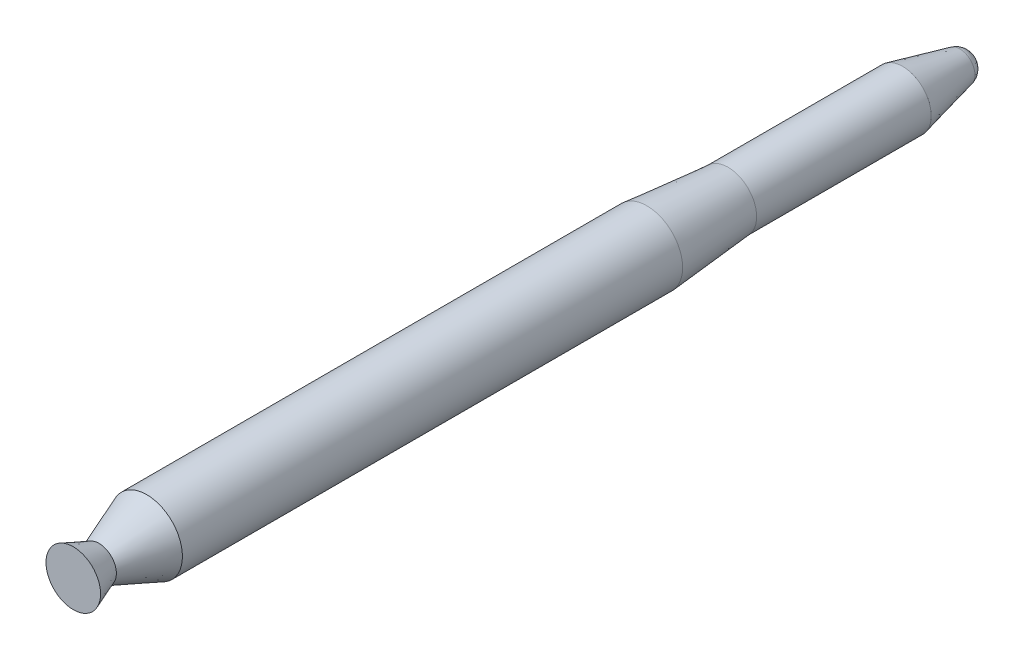
from build123d import *


with BuildPart() as part:
    # Sketch1 → Revolve1 (revolve)
    with BuildSketch(Plane(origin=(0, 0, 0), x_dir=(1, 0, 0), z_dir=(0, 1, 0))):
        with BuildLine():
            Line((2500, 0), (2500, 35000))
            Line((2500, 35000), (2000, 40678.027826631))
            Line((2000, 40678.027826631), (2000, 45962.41287874))
            Line((2000, 45962.41287874), (2000, 52893.41287874))
            Line((2000, 52893.41287874), (1060.397399135, 56895.743003017))
            ThreePointArc((1060.397399135, 56895.743003017), (673.272797982, 57477.208988598), (0, 57663.41287874))
            Line((0, 57663.41287874), (0, 49300))
            Line((0, 49300), (0, 40678.027826631))
            Line((0, 40678.027826631), (0, 35000))
            Line((0, 35000), (0, 0))
            Line((0, 0), (0, -3336.58712126))
            Line((0, -3336.58712126), (1215, -3336.58712126))
            Line((1215, -3336.58712126), (2500, 0))
        make_face()
    revolve(axis=Axis((0, 0, 0), (0, 0, -1)))

    # Sketch2 → Revolve2 (revolve)
    with BuildSketch(Plane(origin=(0, 0, 0), x_dir=(1, 0, 0), z_dir=(0, 1, 0))):
        Polygon((1215, -3336.58712126), (1909.097144705, -5136.58712126), (0, -5136.58712126), (0, -3336.58712126), align=None)
    revolve(axis=Axis((0, 0, 0), (0, 0, 1)))


solid = part.part
